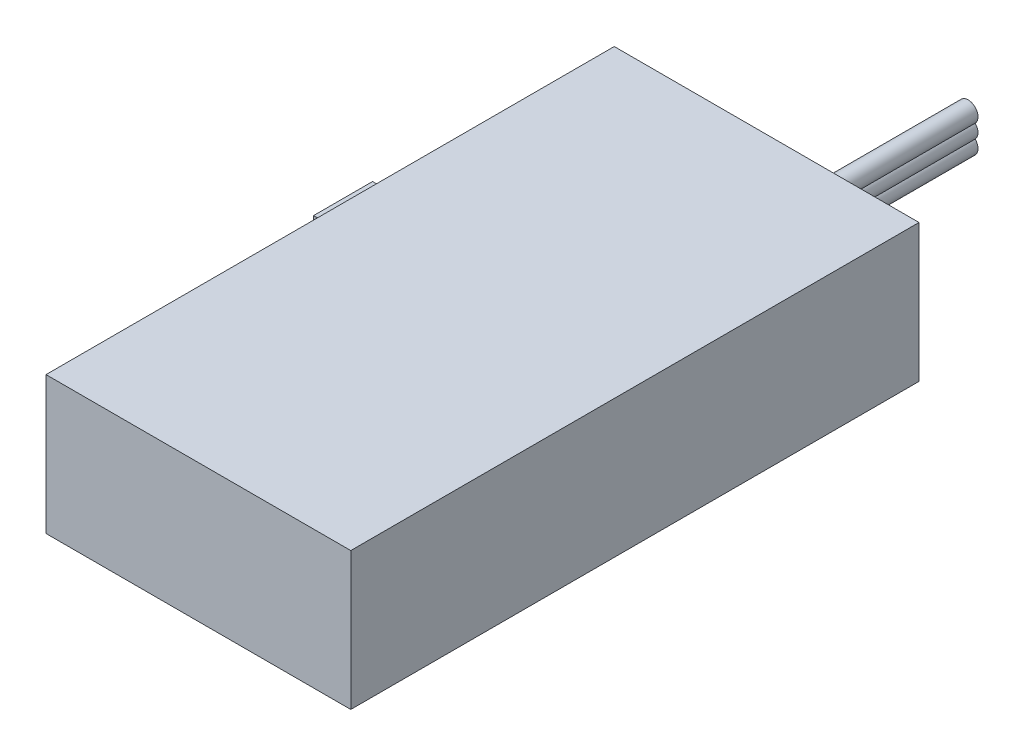
from build123d import *

# Parameters (mm, degrees)
ESQUISSE1_W             = 15.5
ESQUISSE1_H             = 28.9
BOSS_EXTRU_1_DEPTH      = 7
ESQUISSE2_W             = 20.6
ESQUISSE2_H             = 2.4
ENL_V_MAT_EXTRU_1_DEPTH = 8
BOSS_EXTRU_2_REACH      = 33.572
ESQUISSE3_R             = 0.4
ESQUISSE4_W             = 3
ESQUISSE4_H             = 2.4
BOSS_EXTRU_4_DEPTH      = 5.5
ESQUISSE6_R             = 0.5
BOSS_EXTRU_5_DEPTH      = 9


with BuildPart() as part:
    # Esquisse1 → Boss.-Extru.1 (new body)
    with BuildSketch(Plane(origin=(0, 0, 0), x_dir=(1, 0, 0), z_dir=(0, 1, 0))):
        with Locations((7.75, -14.45)):
            Rectangle(ESQUISSE1_W, ESQUISSE1_H)
    extrude(amount=BOSS_EXTRU_1_DEPTH)

    # Esquisse2 → Enlèv. mat.-Extru.1 (cut)
    with BuildSketch(Plane.ZY):
        with Locations((12.6, 3.5)):
            Rectangle(ESQUISSE2_W, ESQUISSE2_H)
    extrude(amount=-ENL_V_MAT_EXTRU_1_DEPTH, mode=Mode.SUBTRACT)

    # Esquisse3 → Boss.-Extru.2 (add, up to next)
    with BuildSketch(Plane.XY.offset(2.3), mode=Mode.PRIVATE) as boss_extru_2_sk1:
        with Locations(Location((3.4, 3.5, 0), (0, 0, 90))):
            Circle(ESQUISSE3_R)
    boss_extru_2_tool1 = extrude(boss_extru_2_sk1.sketch, amount=BOSS_EXTRU_2_REACH, mode=Mode.PRIVATE) - part.part
    add(boss_extru_2_tool1.solids().sort_by_distance((3.4, 3.5, 2.3))[0])

    # Esquisse6 → Boss.-Extru.5 (add)
    with BuildSketch(Plane(origin=(0, 0, 0), x_dir=(-1, 0, 0), z_dir=(0, 0, -1))):
        with Locations((-9, 4.15)):
            Circle(ESQUISSE6_R)
        with Locations((-9, 3.45)):
            Circle(ESQUISSE6_R)
        with Locations((-9, 2.75)):
            Circle(ESQUISSE6_R)
    extrude(amount=BOSS_EXTRU_5_DEPTH)


with BuildPart() as body_2:
    # Esquisse4 → Boss.-Extru.4 (new body)
    with BuildSketch(Plane.ZY.offset(-3)):
        with Locations((11.292047873, 3.5)):
            Rectangle(ESQUISSE4_W, ESQUISSE4_H)
    extrude(amount=BOSS_EXTRU_4_DEPTH)


solid = Compound([part.part, body_2.part])
